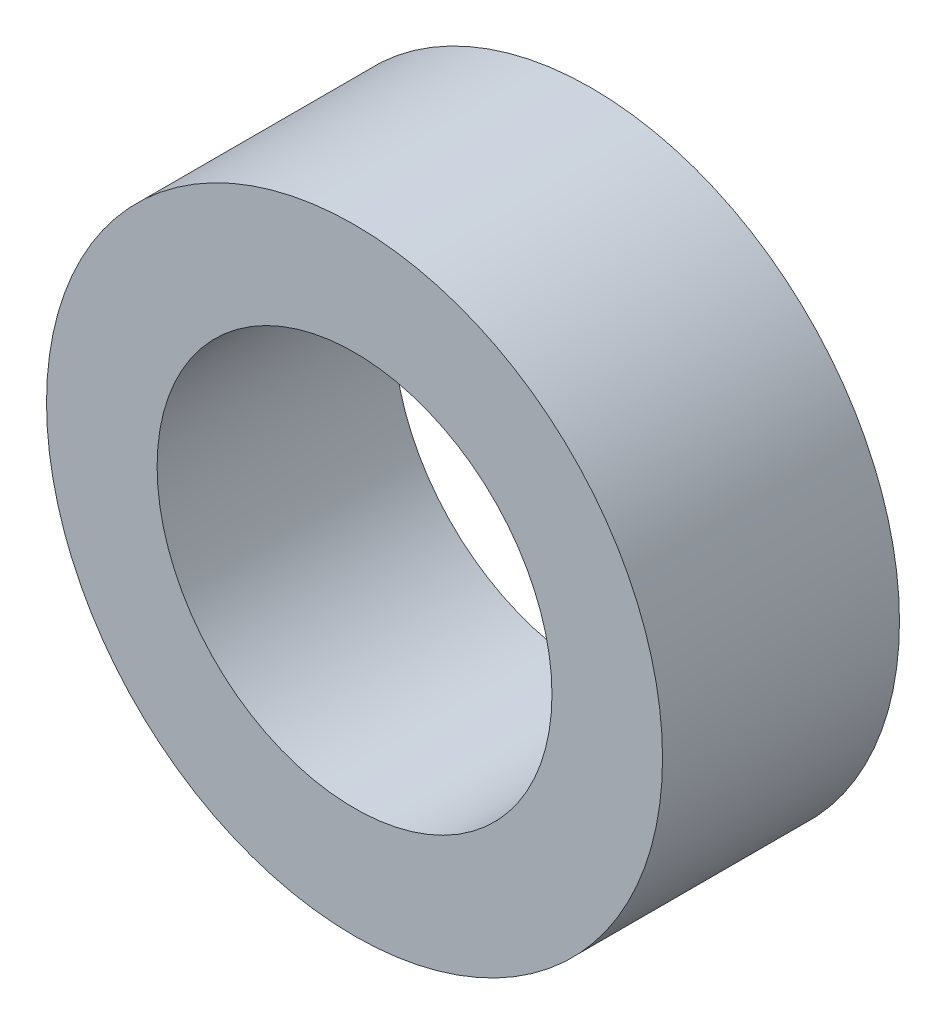
from build123d import *

# Parameters (mm, degrees)
SKETCH1_R      = 3.9
SKETCH1_R_2    = 2.5
EXTRUDE1_DEPTH = 3


with BuildPart() as part:
    # Sketch1 → Extrude1 (new body)
    with BuildSketch(Plane.XY):
        Circle(SKETCH1_R)
        Circle(SKETCH1_R_2, mode=Mode.SUBTRACT)
    extrude(amount=EXTRUDE1_DEPTH)


solid = part.part
